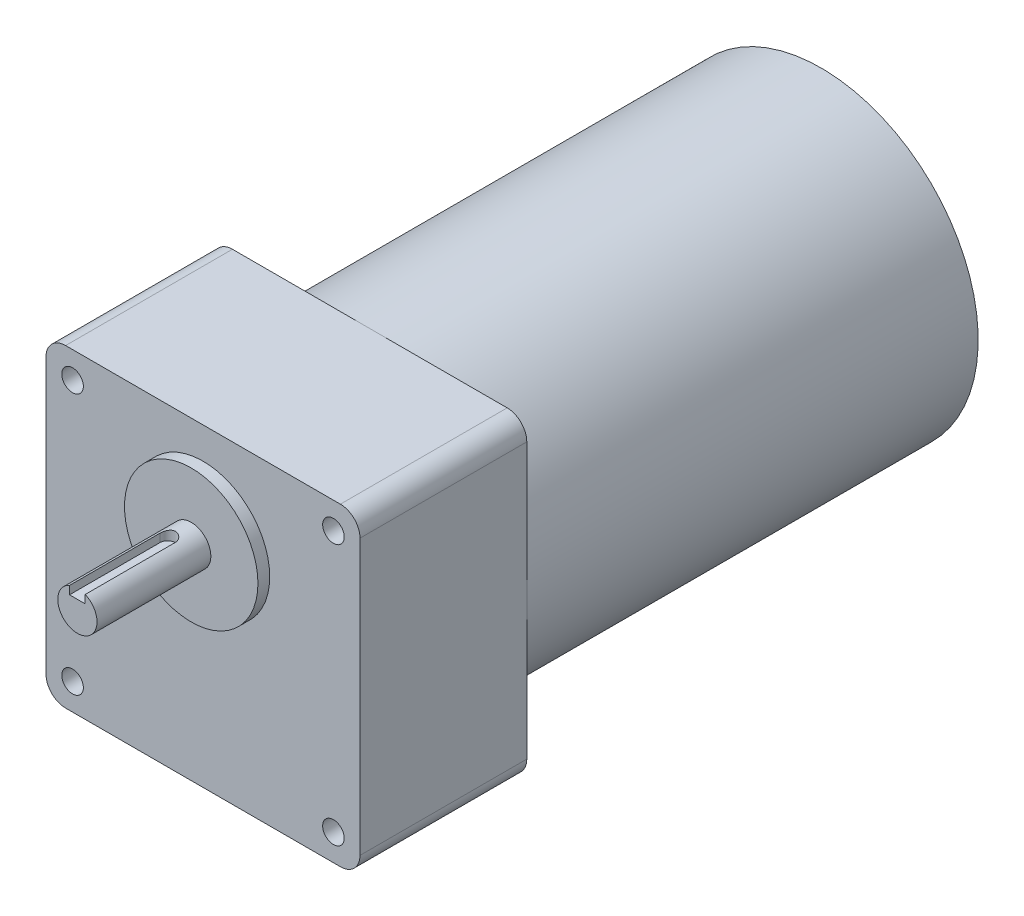
from build123d import *

# Parameters (mm, degrees)
SKETCH_1_W          = 80
SKETCH_1_H          = 80
EXTRUDE_1_DEPTH     = 10
SKETCH_2_R          = 17
EXTRUDE_2_DEPTH     = 3
SKETCH_3_R          = 5
EXTRUDE_3_DEPTH     = 29
CUT_EXTRUDE_1_DEPTH = 23
CUT_EXTRUDE_4_DEPTH = 2.5
SKETCH_7_W          = 80
SKETCH_7_H          = 80
EXTRUDE_6_DEPTH     = 32.5
SKETCH_10_R         = 40
EXTRUDE_7_DEPTH     = 115
SKETCH_11_R         = 14
EXTRUDE_8_DEPTH     = 5
SKETCH_12_R         = 2.75
CUT_EXTRUDE_5_DEPTH = 173.064668076
FILLET_1_R          = 5


with BuildPart() as part:
    # 스케치1 → 보스-돌출1 (new body)
    with BuildSketch(Plane.XY):
        Rectangle(SKETCH_1_W, SKETCH_1_H)
    extrude(amount=EXTRUDE_1_DEPTH)

    # 스케치2 → 보스-돌출2 (add)
    with BuildSketch(Plane.XY.offset(10)):
        with Locations((0, 15)):
            Circle(SKETCH_2_R)
    extrude(amount=EXTRUDE_2_DEPTH)

    # 스케치3 → 보스-돌출3 (add)
    with BuildSketch(Plane.XY.offset(13)):
        with Locations(Location((0, 15, 0), (0, 0, 180))):
            Circle(SKETCH_3_R)
    extrude(amount=EXTRUDE_3_DEPTH)

    # 스케치4 → 컷-돌출1 (cut)
    with BuildSketch(Plane.XY.offset(42)):
        Polygon((0, 17.5), (-2, 17.5), (-2, 20.912683476), (2, 20.912683476), (2, 17.5), align=None)
    extrude(amount=-CUT_EXTRUDE_1_DEPTH, mode=Mode.SUBTRACT)

    # 스케치6 → 컷-돌출4 (cut)
    with BuildSketch(Plane(origin=(0, 20, 0), x_dir=(1, 0, 0), z_dir=(0, 1, 0))):
        with BuildLine():
            Line((-2, -19), (-2, -52.407669752))
            Line((-2, -52.407669752), (2, -52.407669752))
            Line((2, -52.407669752), (2, -19))
            ThreePointArc((2, -19), (0, -17), (-2, -19))
        make_face()
    extrude(amount=-CUT_EXTRUDE_4_DEPTH, mode=Mode.SUBTRACT)

    # 스케치7 → 보스-돌출6 (add)
    with BuildSketch(Plane(origin=(0, 0, 0), x_dir=(-1, 0, 0), z_dir=(0, 0, -1))):
        Rectangle(SKETCH_7_W, SKETCH_7_H)
    extrude(amount=EXTRUDE_6_DEPTH)

    # 스케치10 → 보스-돌출7 (add)
    with BuildSketch(Plane(origin=(0, 0, -32.5), x_dir=(-1, 0, 0), z_dir=(0, 0, -1))):
        Circle(SKETCH_10_R)
    extrude(amount=EXTRUDE_7_DEPTH)

    # 스케치11 → 보스-돌출8 (add)
    with BuildSketch(Plane(origin=(0, 0, -147.5), x_dir=(-1, 0, 0), z_dir=(0, 0, -1))):
        Circle(SKETCH_11_R)
    extrude(amount=EXTRUDE_8_DEPTH)

    # 스케치12 → 컷-돌출5 (cut, through all)
    with BuildSketch(Plane.XY.offset(10)):
        with Locations((33.234018716, 33.234018716)):
            Circle(SKETCH_12_R)
        with Locations((-33.234018716, 33.234018716)):
            Circle(SKETCH_12_R)
        with Locations((-33.234018716, -33.234018716)):
            Circle(SKETCH_12_R)
        with Locations((33.234018716, -33.234018716)):
            Circle(SKETCH_12_R)
    extrude(amount=-CUT_EXTRUDE_5_DEPTH, mode=Mode.SUBTRACT)

    # 필렛1
    fillet_1_edges = [part.edges().sort_by_distance(p)[0] for p in [
        (40, -40, -11.25),
        (-40, -40, -11.25),
        (-40, 40, -11.25),
        (40, 40, -11.25),
    ]]
    fillet(fillet_1_edges, radius=FILLET_1_R)


solid = part.part
